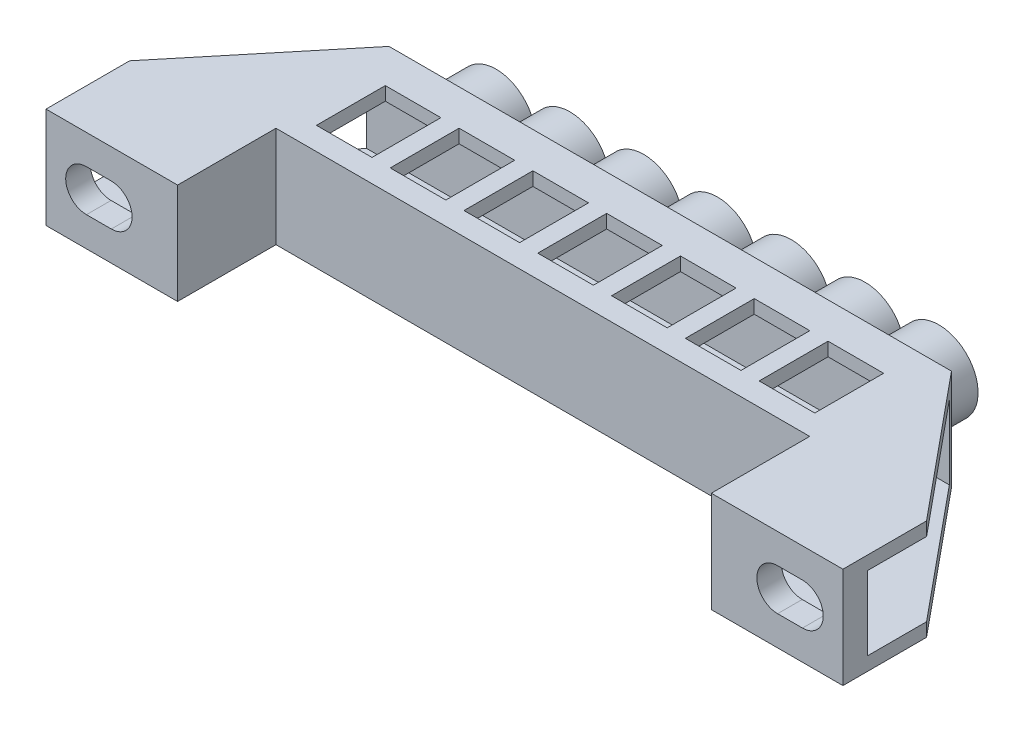
from build123d import *

# Parameters (mm, degrees)
SKETCH1_W           = 5.7404
SKETCH1_H           = 7.112
BOSS_EXTRUDE1_DEPTH = 10.414
CUT_EXTRUDE1_START  = -2.54
SKETCH3_W           = 12.1412
SKETCH3_H           = 7.62
CUT_EXTRUDE1_DEPTH  = 19.5072
SKETCH4_W           = 10.922
SKETCH4_H           = 7.62
CUT_EXTRUDE2_DEPTH  = 73.133620947
CUT_EXTRUDE3_DEPTH  = 48.257817764
SKETCH6_R           = 3.175
BOSS_EXTRUDE2_DEPTH = 4.8768


with BuildPart() as part:
    # Sketch1 → Boss-Extrude1 (new body)
    with BuildSketch(Plane(origin=(0, 0, 0), x_dir=(1, 0, 0), z_dir=(0, 1, 0))):
        Polygon((-41.148, -10.16), (-27.559, -10.16), (-27.559, 0), (27.559, 0), (27.559, -10.16), (41.148, -10.16), (41.148, -1.524), (29.0449, 13.1572), (-29.0449, 13.1572), (-41.148, -1.524), align=None)
        with Locations((7.62, 5.9055)):
            Rectangle(SKETCH1_W, SKETCH1_H, mode=Mode.SUBTRACT)
        with Locations((0, 5.9055)):
            Rectangle(SKETCH1_W, SKETCH1_H, mode=Mode.SUBTRACT)
        with Locations((15.24, 5.9055)):
            Rectangle(SKETCH1_W, SKETCH1_H, mode=Mode.SUBTRACT)
        with Locations((22.86, 5.9055)):
            Rectangle(SKETCH1_W, SKETCH1_H, mode=Mode.SUBTRACT)
        with Locations((-7.62, 5.9055)):
            Rectangle(SKETCH1_W, SKETCH1_H, mode=Mode.SUBTRACT)
        with Locations((-15.24, 5.9055)):
            Rectangle(SKETCH1_W, SKETCH1_H, mode=Mode.SUBTRACT)
        with Locations((-22.86, 5.9055)):
            Rectangle(SKETCH1_W, SKETCH1_H, mode=Mode.SUBTRACT)
    extrude(amount=BOSS_EXTRUDE1_DEPTH)

    # Sketch3 → Cut-Extrude1 (cut)
    with BuildSketch(Plane.XY.offset(10.16).offset(CUT_EXTRUDE1_START)):
        with Locations((35.0774, 5.207)):
            Rectangle(SKETCH3_W, SKETCH3_H)
    cut_extrude1 = extrude(amount=-CUT_EXTRUDE1_DEPTH, mode=Mode.SUBTRACT)

    # Sketch4 → Cut-Extrude2 (cut, through all)
    with BuildSketch(Plane(origin=(29.0068, 0, 0), x_dir=(0, 0, -1), z_dir=(1, 0, 0))):
        with Locations((6.4262, 5.207)):
            Rectangle(SKETCH4_W, SKETCH4_H)
    extrude(amount=-CUT_EXTRUDE2_DEPTH, mode=Mode.SUBTRACT)

    # Sketch5 → Cut-Extrude3 (cut, through all)
    with BuildSketch(Plane(origin=(0, 0, 7.62), x_dir=(-1, 0, 0), z_dir=(0, 0, -1))):
        with BuildLine():
            Line((-34.4043, 3.0607), (-36.9697, 3.0607))
            ThreePointArc((-36.9697, 3.0607), (-39.116, 5.207), (-36.9697, 7.3533))
            Line((-36.9697, 7.3533), (-34.4043, 7.3533))
            ThreePointArc((-34.4043, 7.3533), (-32.258, 5.207), (-34.4043, 3.0607))
        make_face()
    cut_extrude3 = extrude(amount=-CUT_EXTRUDE3_DEPTH, mode=Mode.SUBTRACT)

    # Mirror1: Cut-Extrude1, Cut-Extrude3 across plane
    add(cut_extrude1.mirror(Plane(origin=(0, 0, 0), x_dir=(0, 0, 1), z_dir=(1, 0, 0))), mode=Mode.SUBTRACT)
    add(cut_extrude3.mirror(Plane(origin=(0, 0, 0), x_dir=(0, 0, 1), z_dir=(1, 0, 0))), mode=Mode.SUBTRACT)

    # Sketch6 → Boss-Extrude2 (add)
    with BuildSketch(Plane(origin=(0, 0, -13.1572), x_dir=(-1, 0, 0), z_dir=(0, 0, -1))):
        with BuildLine():
            ThreePointArc((-3.81, 3.602218207), (0, 0.92820964), (3.81, 3.602218207))
            ThreePointArc((3.81, 3.602218207), (7.62, 0.92820964), (11.43, 3.602218207))
            ThreePointArc((11.43, 3.602218207), (15.24, 0.92820964), (19.05, 3.602218207))
            ThreePointArc((19.05, 3.602218207), (26.9113, 4.97950964), (19.05, 6.356801072))
            ThreePointArc((19.05, 6.356801072), (15.24, 9.03080964), (11.43, 6.356801072))
            ThreePointArc((11.43, 6.356801072), (7.62, 9.03080964), (3.81, 6.356801072))
            ThreePointArc((3.81, 6.356801072), (0, 9.03080964), (-3.81, 6.356801072))
            ThreePointArc((-3.81, 6.356801072), (-7.62, 9.03080964), (-11.43, 6.356801072))
            ThreePointArc((-11.43, 6.356801072), (-15.24, 9.03080964), (-19.05, 6.356801072))
            ThreePointArc((-19.05, 6.356801072), (-26.9113, 4.97950964), (-19.05, 3.602218207))
            ThreePointArc((-19.05, 3.602218207), (-15.24, 0.92820964), (-11.43, 3.602218207))
            ThreePointArc((-11.43, 3.602218207), (-7.62, 0.92820964), (-3.81, 3.602218207))
        make_face()
        with Locations((0, 4.97950964)):
            Circle(SKETCH6_R, mode=Mode.SUBTRACT)
        with Locations((7.62, 4.97950964)):
            Circle(SKETCH6_R, mode=Mode.SUBTRACT)
        with Locations((15.24, 4.97950964)):
            Circle(SKETCH6_R, mode=Mode.SUBTRACT)
        with Locations((22.86, 4.97950964)):
            Circle(SKETCH6_R, mode=Mode.SUBTRACT)
        with Locations((-7.62, 4.97950964)):
            Circle(SKETCH6_R, mode=Mode.SUBTRACT)
        with Locations((-15.24, 4.97950964)):
            Circle(SKETCH6_R, mode=Mode.SUBTRACT)
        with Locations((-22.86, 4.97950964)):
            Circle(SKETCH6_R, mode=Mode.SUBTRACT)
    extrude(amount=BOSS_EXTRUDE2_DEPTH)


solid = part.part
